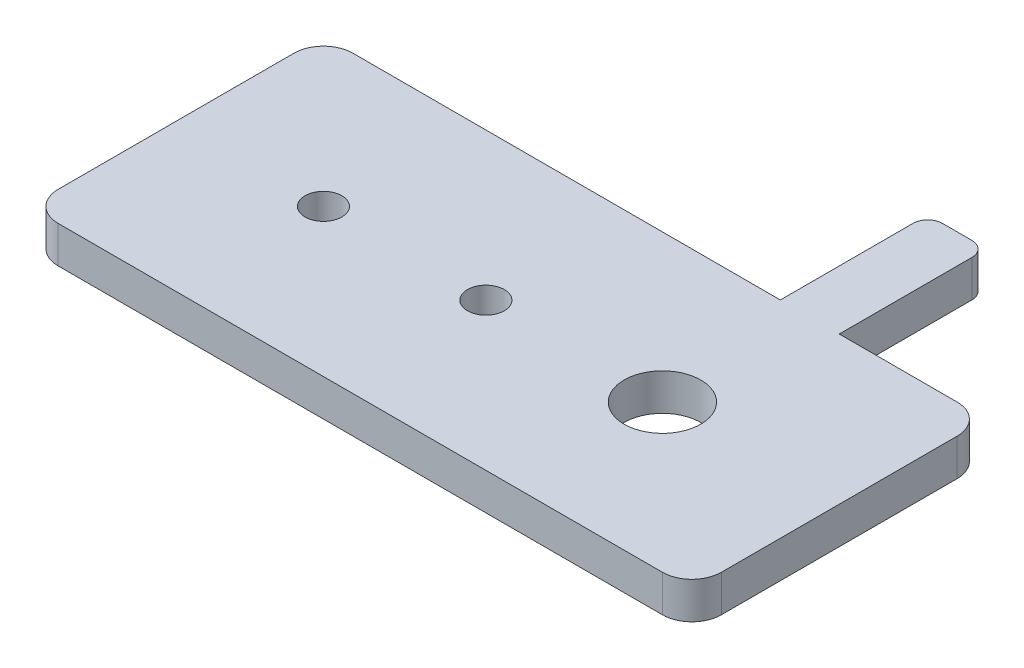
from build123d import *

# Parameters (mm, degrees)
BOSS_EXTRUDE1_DEPTH = 3.175
CUT_EXTRUDE1_REACH  = 70.759
SKETCH2_R           = 1.5875
SKETCH2_R_2         = 3.302


with BuildPart() as part:
    # Sketch1 → Boss-Extrude1 (new body)
    with BuildSketch(Plane(origin=(0, 0, 0), x_dir=(1, 0, 0), z_dir=(0, 1, 0))):
        with BuildLine():
            Line((44.45, 25.4), (54.61, 25.4))
            ThreePointArc((54.61, 25.4), (56.406051224, 24.656051224), (57.15, 22.86))
            Line((57.15, 22.86), (57.15, 2.54))
            ThreePointArc((57.15, 2.54), (56.406051224, 0.743948776), (54.61, 0))
            Line((54.61, 0), (2.54, 0))
            ThreePointArc((2.54, 0), (0.743948776, 0.743948776), (0, 2.54))
            Line((0, 2.54), (0, 22.86))
            ThreePointArc((0, 22.86), (0.743948776, 24.656051224), (2.54, 25.4))
            Line((2.54, 25.4), (39.37, 25.4))
            Line((39.37, 25.4), (39.37, 36.83))
            ThreePointArc((39.37, 36.83), (39.741974388, 37.728025612), (40.64, 38.1))
            Line((40.64, 38.1), (43.18, 38.1))
            ThreePointArc((43.18, 38.1), (44.078025612, 37.728025612), (44.45, 36.83))
            Line((44.45, 36.83), (44.45, 25.4))
        make_face()
    extrude(amount=BOSS_EXTRUDE1_DEPTH)

    # Sketch2 → Cut-Extrude1 (cut, up to next)
    with BuildSketch(Plane(origin=(0, 3.175, 0), x_dir=(1, 0, 0), z_dir=(0, 1, 0)), mode=Mode.PRIVATE) as cut_extrude1_sk1:
        with Locations(Location((12.7, 12.7, 0), (0, 0, 270))):
            Circle(SKETCH2_R)
    cut_extrude1_tool1 = extrude(cut_extrude1_sk1.sketch, amount=-CUT_EXTRUDE1_REACH, mode=Mode.PRIVATE) & part.part
    # Sketch2 → Cut-Extrude1 (cut, up to next)
    with BuildSketch(Plane(origin=(0, 3.175, 0), x_dir=(1, 0, 0), z_dir=(0, 1, 0)), mode=Mode.PRIVATE) as cut_extrude1_sk2:
        with Locations(Location((26.699972, 12.7, 0), (0, 0, 270))):
            Circle(SKETCH2_R)
    cut_extrude1_tool2 = extrude(cut_extrude1_sk2.sketch, amount=-CUT_EXTRUDE1_REACH, mode=Mode.PRIVATE) & part.part
    # Sketch2 → Cut-Extrude1 (cut, up to next)
    with BuildSketch(Plane(origin=(0, 3.175, 0), x_dir=(1, 0, 0), z_dir=(0, 1, 0)), mode=Mode.PRIVATE) as cut_extrude1_sk3:
        with Locations(Location((41.91, 12.7, 0), (0, 0, 270))):
            Circle(SKETCH2_R_2)
    cut_extrude1_tool3 = extrude(cut_extrude1_sk3.sketch, amount=-CUT_EXTRUDE1_REACH, mode=Mode.PRIVATE) & part.part
    add(cut_extrude1_tool1.solids().sort_by_distance((12.7, 3.175, -12.7))[0], mode=Mode.SUBTRACT)
    add(cut_extrude1_tool2.solids().sort_by_distance((26.699972, 3.175, -12.7))[0], mode=Mode.SUBTRACT)
    add(cut_extrude1_tool3.solids().sort_by_distance((41.91, 3.175, -12.7))[0], mode=Mode.SUBTRACT)


solid = part.part
